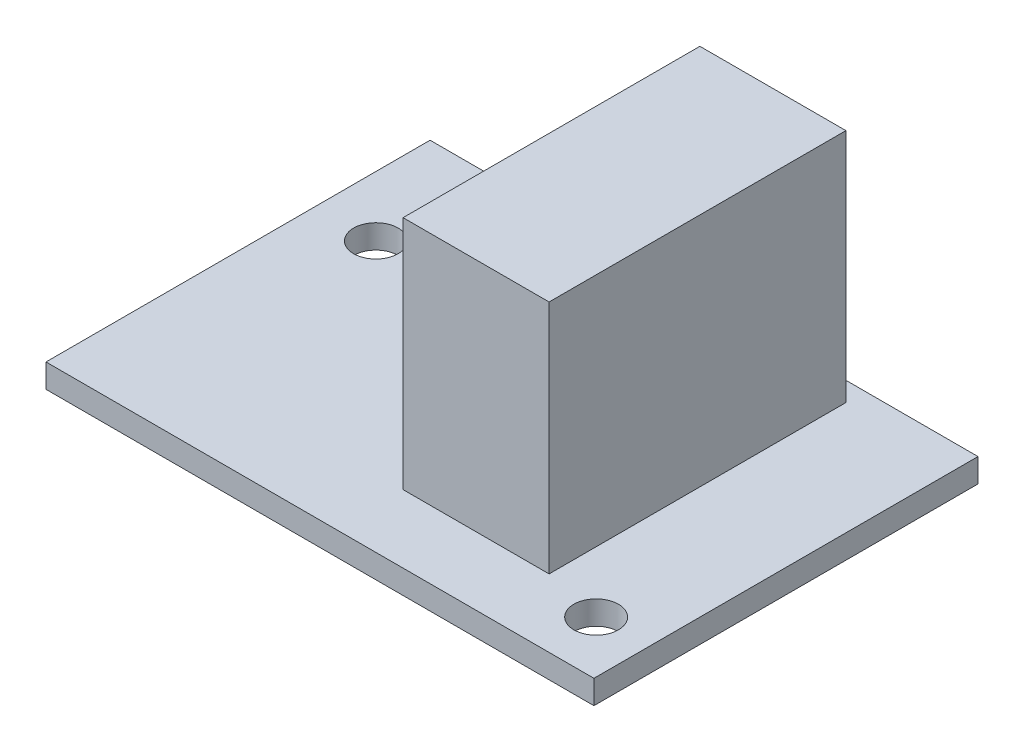
from build123d import *

# Parameters (mm, degrees)
SKETCH1_W           = 36.92
SKETCH1_H           = 25.88
SKETCH1_R           = 1.5
BOSS_EXTRUDE1_DEPTH = 1.6
SKETCH2_W           = 9.84
SKETCH2_H           = 20
BOSS_EXTRUDE2_DEPTH = 15.87


with BuildPart() as part:
    # Sketch1 → Boss-Extrude1 (new body)
    with BuildSketch(Plane(origin=(0, 0, 0), x_dir=(1, 0, 0), z_dir=(0, 1, 0))):
        with Locations((18.46, 12.94)):
            Rectangle(SKETCH1_W, SKETCH1_H)
        with Locations(Location((33.42, 3.65, 0), (0, 0, 270))):
            Circle(SKETCH1_R, mode=Mode.SUBTRACT)
        with Locations(Location((4.05, 18.18, 0), (0, 0, 270))):
            Circle(SKETCH1_R, mode=Mode.SUBTRACT)
    extrude(amount=BOSS_EXTRUDE1_DEPTH)

    # Sketch2 → Boss-Extrude2 (add)
    with BuildSketch(Plane(origin=(0, 1.6, 0), x_dir=(1, 0, 0), z_dir=(0, 1, 0))):
        with Locations((24.4, 14.58)):
            Rectangle(SKETCH2_W, SKETCH2_H)
    extrude(amount=BOSS_EXTRUDE2_DEPTH)


solid = part.part
